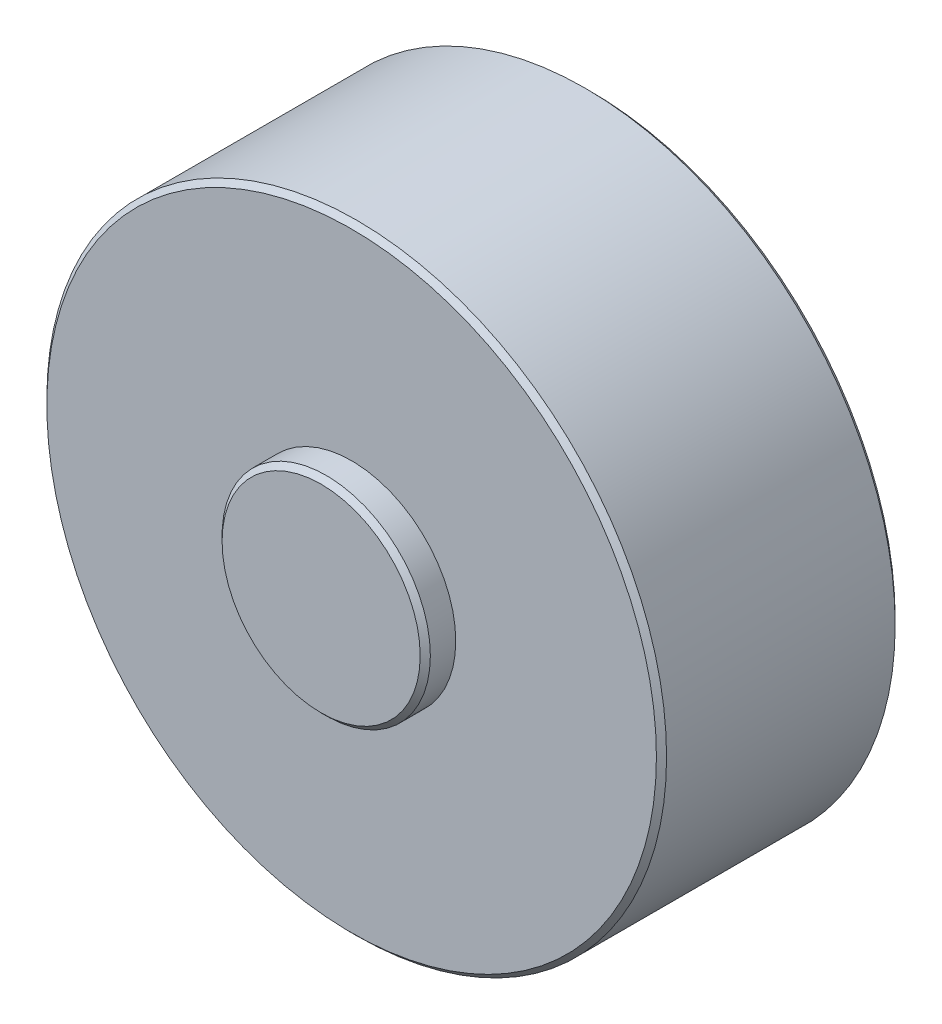
from build123d import *

# Parameters (mm, degrees)
SKETCH_1_R      = 61
EXTRUDE_1_DEPTH = 47
SKETCH_2_R      = 20.5
EXTRUDE_2_DEPTH = 6
CHAMFER_1_SIZE  = 1


with BuildPart() as part:
    # 草图1 → 凸台-拉伸1 (new body)
    with BuildSketch(Plane.XY):
        Circle(SKETCH_1_R)
    extrude(amount=EXTRUDE_1_DEPTH)

    # 草图2 → 凸台-拉伸2 (add)
    with BuildSketch(Plane.XY.offset(47)):
        Circle(SKETCH_2_R)
    extrude(amount=EXTRUDE_2_DEPTH)

    # 倒角1
    chamfer_1_edges = [part.edges().sort_by_distance(p)[0] for p in [
        (-61, 0, 0),
        (-61, 0, 47),
        (-20.5, 0, 53),
    ]]
    chamfer(chamfer_1_edges, length=CHAMFER_1_SIZE)


solid = part.part
